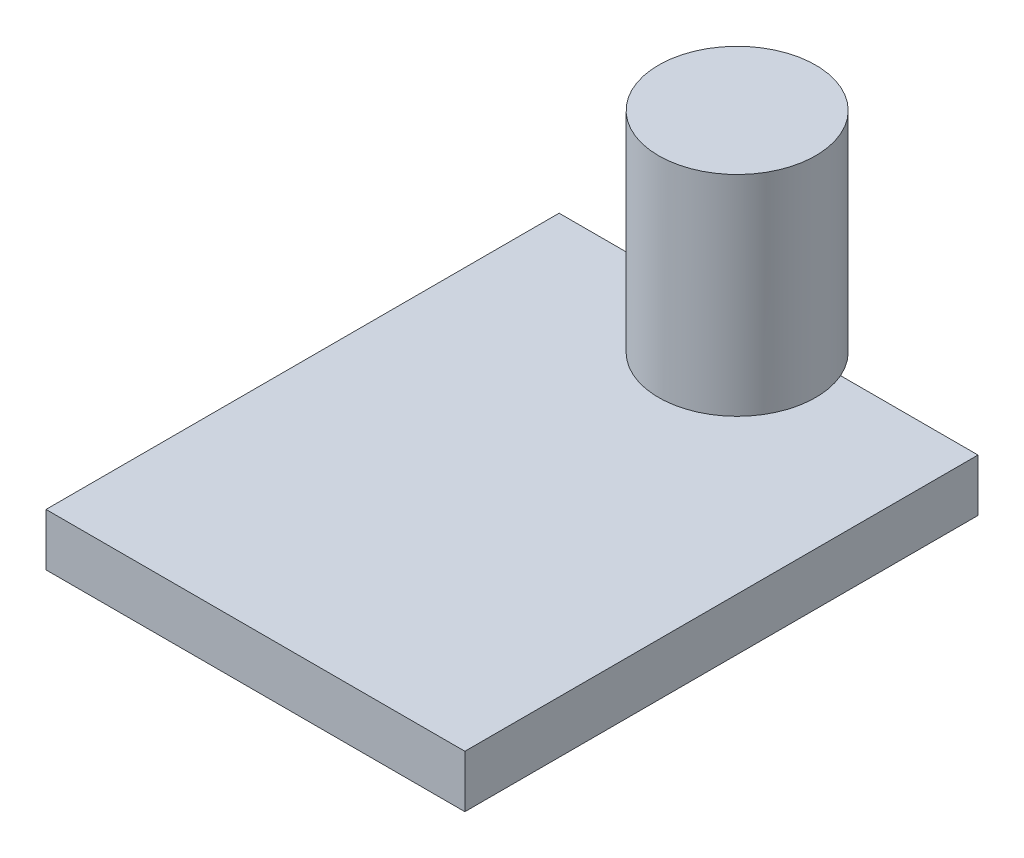
from build123d import *

# Parameters (mm, degrees)
SKETCH1_W           = 40
SKETCH1_H           = 49
BOSS_EXTRUDE1_DEPTH = 5
SKETCH2_R           = 7.5
BOSS_EXTRUDE2_DEPTH = 20


with BuildPart() as part:
    # Sketch1 → Boss-Extrude1 (new body)
    with BuildSketch(Plane(origin=(0, 0, 0), x_dir=(1, 0, 0), z_dir=(0, 1, 0))):
        Rectangle(SKETCH1_W, SKETCH1_H)
    extrude(amount=BOSS_EXTRUDE1_DEPTH)

    # Sketch2 → Boss-Extrude2 (add)
    with BuildSketch(Plane(origin=(0, 5, 0), x_dir=(1, 0, 0), z_dir=(0, 1, 0))):
        with Locations(Location((0, 21.5, 0), (0, 0, 23.578178478))):
            Circle(SKETCH2_R)
    extrude(amount=BOSS_EXTRUDE2_DEPTH)


solid = part.part
